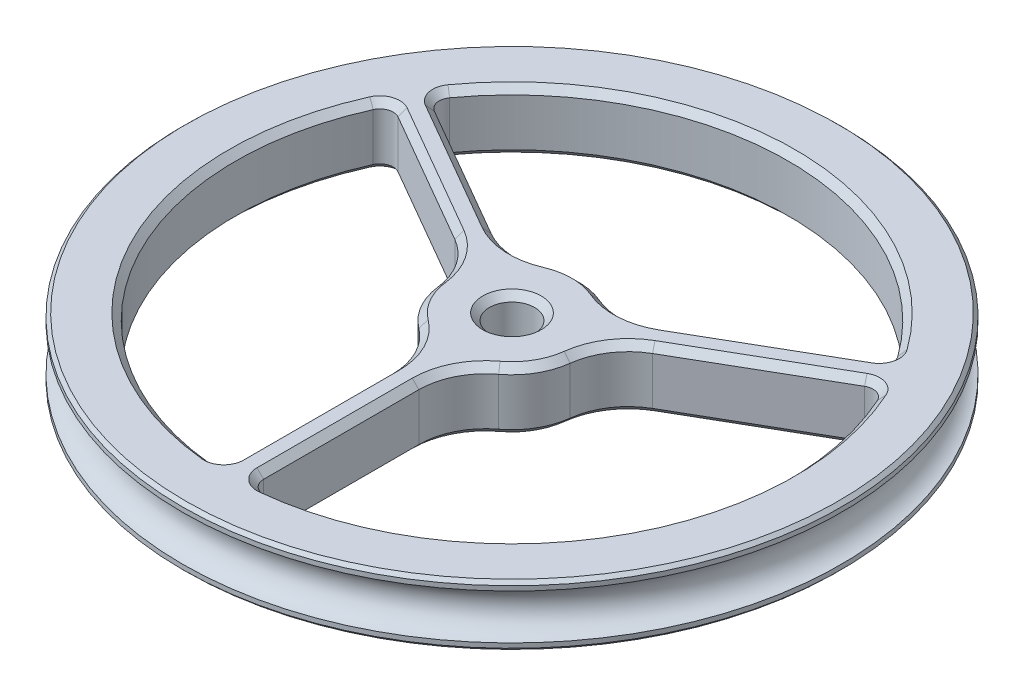
from build123d import *

# Parameters (mm, degrees)
SKETCH1_R           = 24.765
BOSS_EXTRUDE1_DEPTH = 2.286
SKETCH2_R           = 1.7145
SKETCH3_R           = 1.7
CUT_EXTRUDE1_DEPTH  = 36.320159031
CUT_EXTRUDE2_DEPTH  = 36.320159031
CIRPATTERN1_COUNT   = 3
FILLET1_R           = 5
FILLET4_R           = 1
CHAMFER1_SIZE       = 0.5
CHAMFER2_SIZE       = 0.5
CHAMFER3_SIZE       = 0.25


with BuildPart() as part:
    # Sketch1 → Boss-Extrude1 (new, symmetric)
    with BuildSketch(Plane(origin=(0, 0, 0), x_dir=(1, 0, 0), z_dir=(0, 1, 0))):
        with Locations(Location((0, 0, 0), (0, 0, 270))):
            Circle(SKETCH1_R)
    extrude(amount=BOSS_EXTRUDE1_DEPTH, both=True)

    # Sketch2 → Cut-Revolve1 (revolve, cut)
    with BuildSketch(Plane(origin=(0, 0, 0), x_dir=(0, 0, -1), z_dir=(1, 0, 0))):
        with Locations((25.065, 0)):
            Circle(SKETCH2_R)
    revolve(axis=Axis((0, 0, 0), (0, 1, 0)), mode=Mode.SUBTRACT)

    # Sketch3 → Cut-Extrude1 (cut, through all)
    with BuildSketch(Plane(origin=(0, 2.286, 0), x_dir=(1, 0, 0), z_dir=(0, 1, 0))):
        with Locations(Location((0, 0, 0), (0, 0, 270))):
            Circle(SKETCH3_R)
    extrude(amount=-CUT_EXTRUDE1_DEPTH, mode=Mode.SUBTRACT)

    # Sketch4 → Cut-Extrude2 (cut, through all)
    with BuildSketch(Plane(origin=(0, 2.286, 0), x_dir=(1, 0, 0), z_dir=(0, 1, 0))):
        with BuildLine():
            Line((3.742640687, 3.315515147), (17.462152397, 11.236478926))
            ThreePointArc((17.462152397, 11.236478926), (0, 20.765), (-17.462152397, 11.236478926))
            Line((-17.462152397, 11.236478926), (-3.742640687, 3.315515147))
            ThreePointArc((-3.742640687, 3.315515147), (0, 5), (3.742640687, 3.315515147))
        make_face()
    cut_extrude2 = extrude(amount=-CUT_EXTRUDE2_DEPTH, mode=Mode.SUBTRACT)

    # CirPattern1: Cut-Extrude2 ×3 about axis
    cirpattern1_axis = Axis((0, 0, 0), (0, 1, 0))
    for i in range(1, CIRPATTERN1_COUNT):
        add(cut_extrude2.rotate(cirpattern1_axis, i * 360 / CIRPATTERN1_COUNT), mode=Mode.SUBTRACT)

    # Fillet1
    fillet1_edges = [part.edges().sort_by_distance(p)[0] for p in [
        (3.742640687, 0, -3.315515147),
        (-3.742640687, 0, -3.315515147),
        (1, 0, 4.898979486),
        (4.742640687, 0, -1.583464339),
        (-4.742640687, 0, -1.583464339),
        (-1, 0, 4.898979486),
    ]]
    fillet(fillet1_edges, radius=FILLET1_R)

    # Fillet4
    fillet4_edges = [part.edges().sort_by_distance(p)[0] for p in [
        (-17.462152397, 0, -11.236478926),
        (17.462152397, 0, -11.236478926),
        (18.462152397, 0, -9.504428118),
        (1, 0, 20.740907044),
        (-1, 0, 20.740907044),
        (-18.462152397, 0, -9.504428118),
    ]]
    fillet(fillet4_edges, radius=FILLET4_R)

    # Chamfer1
    chamfer1_edges = [part.edges().sort_by_distance(p)[0] for p in [
        (0, -2.286, -1.7),
        (0, 2.286, -1.7),
    ]]
    chamfer(chamfer1_edges, length=CHAMFER1_SIZE)

    # Chamfer2
    chamfer2_edges = [part.edges().sort_by_distance(p)[0] for p in [
        (-17.98301751, 2.286, 10.3825),
        (-17.98301751, -2.286, 10.3825),
        (-11.47866882, 2.286, -7.781913072),
        (-11.47866882, -2.286, -7.781913072),
        (-1, 2.286, 13.831775336),
        (-1, -2.286, 13.831775336),
        (17.006931622, 2.286, -11.354272778),
        (17.006931622, -2.286, -11.354272778),
        (18.336554478, 2.286, -9.051298436),
        (18.336554478, -2.286, -9.051298436),
        (-18.336554478, 2.286, -9.051298436),
        (-18.336554478, -2.286, -9.051298436),
        (-17.006931622, 2.286, -11.354272778),
        (-17.006931622, -2.286, -11.354272778),
        (1.329622856, 2.286, 20.405571214),
        (1.329622856, -2.286, 20.405571214),
        (-1.329622856, 2.286, 20.405571214),
        (-1.329622856, -2.286, 20.405571214),
        (11.47866882, 2.286, -7.781913072),
        (11.47866882, -2.286, -7.781913072),
        (0, 2.286, -5),
        (0, -2.286, -5),
        (4.330127019, 2.286, 2.5),
        (4.330127019, -2.286, 2.5),
        (1, 2.286, 13.831775336),
        (1, -2.286, 13.831775336),
        (-4.330127019, 2.286, 2.5),
        (-4.330127019, -2.286, 2.5),
        (-12.47866882, 2.286, -6.049862264),
        (-12.47866882, -2.286, -6.049862264),
        (4.227779535, 2.286, -4.205135088),
        (4.227779535, -2.286, -4.205135088),
        (-4.227779535, 2.286, -4.205135088),
        (-4.227779535, -2.286, -4.205135088),
        (5.75564358, 2.286, -1.558796935),
        (5.75564358, -2.286, -1.558796935),
        (1.527864045, 2.286, 5.763932023),
        (1.527864045, -2.286, 5.763932023),
        (-1.527864045, 2.286, 5.763932023),
        (-1.527864045, -2.286, 5.763932023),
        (-5.75564358, 2.286, -1.558796935),
        (-5.75564358, -2.286, -1.558796935),
        (0, 2.286, -20.765),
        (0, -2.286, -20.765),
        (12.47866882, 2.286, -6.049862264),
        (12.47866882, -2.286, -6.049862264),
        (17.98301751, 2.286, 10.3825),
        (17.98301751, -2.286, 10.3825),
    ]]
    chamfer(chamfer2_edges, length=CHAMFER2_SIZE)

    # Chamfer3
    chamfer3_edges = [part.edges().sort_by_distance(p)[0] for p in [
        (0, -2.286, -24.765),
        (0, 2.286, -24.765),
    ]]
    chamfer(chamfer3_edges, length=CHAMFER3_SIZE)


solid = part.part
